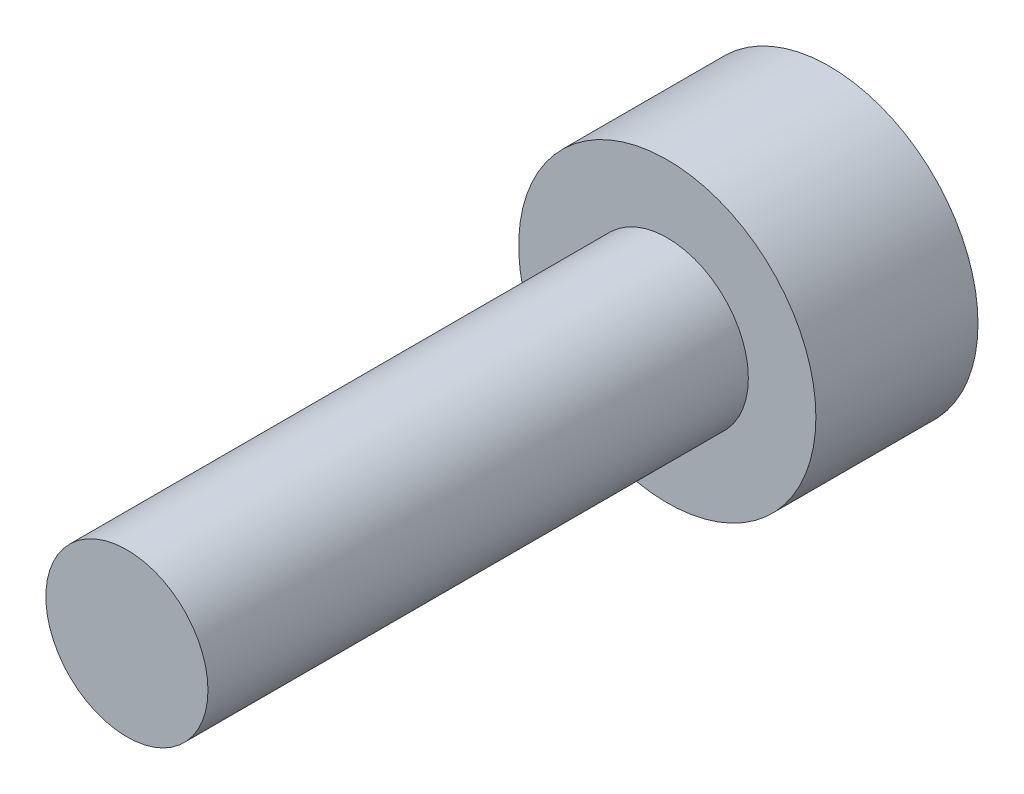
from build123d import *

# Parameters (mm, degrees)
CABEZA_START            = -3
CROQUIS1_R              = 2.75
CABEZA_DEPTH            = 3
CROQUIS2_R              = 1.5
CUERPO_DEPTH            = 10
HEXAGONO_INTERIOR_START = -3
HEXAGONO_INTERIOR_DEPTH = 1.3


with BuildPart() as part:
    # Croquis1 → Cabeza (new body)
    with BuildSketch(Plane.XY.offset(CABEZA_START)):
        Circle(CROQUIS1_R)
    extrude(amount=CABEZA_DEPTH)

    # Croquis2 → Cuerpo (add)
    with BuildSketch(Plane.XY):
        Circle(CROQUIS2_R)
    extrude(amount=CUERPO_DEPTH)

    # Croquis3 → Hexagono_interior (cut)
    with BuildSketch(Plane.XY.offset(HEXAGONO_INTERIOR_START)):
        Polygon((1.443375673, 0), (0.721687836, 1.25), (-0.721687836, 1.25), (-1.443375673, 0), (-0.721687836, -1.25), (0.721687836, -1.25), align=None)
    extrude(amount=HEXAGONO_INTERIOR_DEPTH, mode=Mode.SUBTRACT)


solid = part.part
